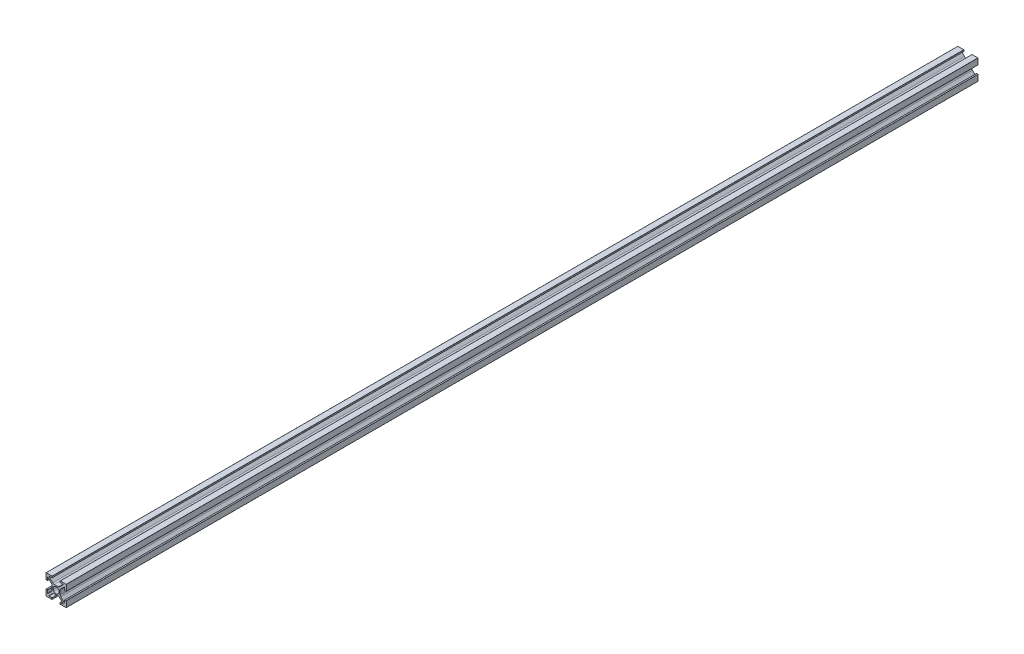
from build123d import *

# Parameters (mm, degrees)
SKETCH1_R           = 3
BOSS_EXTRUDE2_DEPTH = 900


with BuildPart() as part:
    # Sketch1 → Boss-Extrude2 (new body)
    with BuildSketch(Plane.XY.offset(60)):
        with BuildLine():
            Line((18.5, 17.008578644), (18.5, 14.1))
            ThreePointArc((18.5, 14.1), (18.529289322, 14.029289322), (18.6, 14))
            Line((18.6, 14), (19.9, 14))
            ThreePointArc((19.9, 14), (19.970710678, 14.029289322), (20, 14.1))
            Line((20, 14.1), (20, 19.9))
            ThreePointArc((20, 19.9), (19.970710678, 19.970710678), (19.9, 20))
            Line((19.9, 20), (14.1, 20))
            ThreePointArc((14.1, 20), (14.029289322, 19.970710678), (14, 19.9))
            Line((14, 19.9), (14, 18.6))
            ThreePointArc((14, 18.6), (14.029289322, 18.529289322), (14.1, 18.5))
            Line((14.1, 18.5), (17.008578644, 18.5))
            ThreePointArc((17.008578644, 18.5), (17.100966597, 18.438268343), (17.079289322, 18.329289322))
            Line((17.079289322, 18.329289322), (13.335786438, 14.585786438))
            ThreePointArc((13.335786438, 14.585786438), (12.68693974, 14.152240935), (11.921572875, 14))
            Line((11.921572875, 14), (8.078427125, 14))
            ThreePointArc((8.078427125, 14), (7.31306026, 14.152240935), (6.664213562, 14.585786438))
            Line((6.664213562, 14.585786438), (2.920710678, 18.329289322))
            ThreePointArc((2.920710678, 18.329289322), (2.899033403, 18.438268343), (2.991421356, 18.5))
            Line((2.991421356, 18.5), (5.9, 18.5))
            ThreePointArc((5.9, 18.5), (5.970710678, 18.529289322), (6, 18.6))
            Line((6, 18.6), (6, 19.9))
            ThreePointArc((6, 19.9), (5.970710678, 19.970710678), (5.9, 20))
            Line((5.9, 20), (0.1, 20))
            ThreePointArc((0.1, 20), (0.029289322, 19.970710678), (0, 19.9))
            Line((0, 19.9), (0, 14.1))
            ThreePointArc((0, 14.1), (0.029289322, 14.029289322), (0.1, 14))
            Line((0.1, 14), (1.4, 14))
            ThreePointArc((1.4, 14), (1.470710678, 14.029289322), (1.5, 14.1))
            Line((1.5, 14.1), (1.5, 17.008578644))
            ThreePointArc((1.5, 17.008578644), (1.561731657, 17.100966597), (1.670710678, 17.079289322))
            Line((1.670710678, 17.079289322), (5.414213562, 13.335786438))
            ThreePointArc((5.414213562, 13.335786438), (5.847759065, 12.68693974), (6, 11.921572875))
            Line((6, 11.921572875), (6, 8.078427125))
            ThreePointArc((6, 8.078427125), (5.847759065, 7.31306026), (5.414213562, 6.664213562))
            Line((5.414213562, 6.664213562), (1.670710678, 2.920710678))
            ThreePointArc((1.670710678, 2.920710678), (1.561731657, 2.899033403), (1.5, 2.991421356))
            Line((1.5, 2.991421356), (1.5, 5.9))
            ThreePointArc((1.5, 5.9), (1.470710678, 5.970710678), (1.4, 6))
            Line((1.4, 6), (0.1, 6))
            ThreePointArc((0.1, 6), (0.029289322, 5.970710678), (0, 5.9))
            Line((0, 5.9), (0, 0.1))
            ThreePointArc((0, 0.1), (0.029289322, 0.029289322), (0.1, 0))
            Line((0.1, 0), (5.9, 0))
            ThreePointArc((5.9, 0), (5.970710678, 0.029289322), (6, 0.1))
            Line((6, 0.1), (6, 1.4))
            ThreePointArc((6, 1.4), (5.970710678, 1.470710678), (5.9, 1.5))
            Line((5.9, 1.5), (2.991421356, 1.5))
            ThreePointArc((2.991421356, 1.5), (2.899033403, 1.561731657), (2.920710678, 1.670710678))
            Line((2.920710678, 1.670710678), (6.664213562, 5.414213562))
            ThreePointArc((6.664213562, 5.414213562), (7.31306026, 5.847759065), (8.078427125, 6))
            Line((8.078427125, 6), (11.921572875, 6))
            ThreePointArc((11.921572875, 6), (12.68693974, 5.847759065), (13.335786438, 5.414213562))
            Line((13.335786438, 5.414213562), (17.079289322, 1.670710678))
            ThreePointArc((17.079289322, 1.670710678), (17.100966597, 1.561731657), (17.008578644, 1.5))
            Line((17.008578644, 1.5), (14.1, 1.5))
            ThreePointArc((14.1, 1.5), (14.029289322, 1.470710678), (14, 1.4))
            Line((14, 1.4), (14, 0.1))
            ThreePointArc((14, 0.1), (14.029289322, 0.029289322), (14.1, 0))
            Line((14.1, 0), (19.9, 0))
            ThreePointArc((19.9, 0), (19.970710678, 0.029289322), (20, 0.1))
            Line((20, 0.1), (20, 5.9))
            ThreePointArc((20, 5.9), (19.970710678, 5.970710678), (19.9, 6))
            Line((19.9, 6), (18.6, 6))
            ThreePointArc((18.6, 6), (18.529289322, 5.970710678), (18.5, 5.9))
            Line((18.5, 5.9), (18.5, 2.991421356))
            ThreePointArc((18.5, 2.991421356), (18.438268343, 2.899033403), (18.329289322, 2.920710678))
            Line((18.329289322, 2.920710678), (14.585786438, 6.664213562))
            ThreePointArc((14.585786438, 6.664213562), (14.152240935, 7.31306026), (14, 8.078427125))
            Line((14, 8.078427125), (14, 11.921572875))
            ThreePointArc((14, 11.921572875), (14.152240935, 12.68693974), (14.585786438, 13.335786438))
            Line((14.585786438, 13.335786438), (18.329289322, 17.079289322))
            ThreePointArc((18.329289322, 17.079289322), (18.438268343, 17.100966597), (18.5, 17.008578644))
        make_face()
        with Locations(Location((10, 10, 0), (0, 0, 180))):
            Circle(SKETCH1_R, mode=Mode.SUBTRACT)
    extrude(amount=BOSS_EXTRUDE2_DEPTH)


solid = part.part
